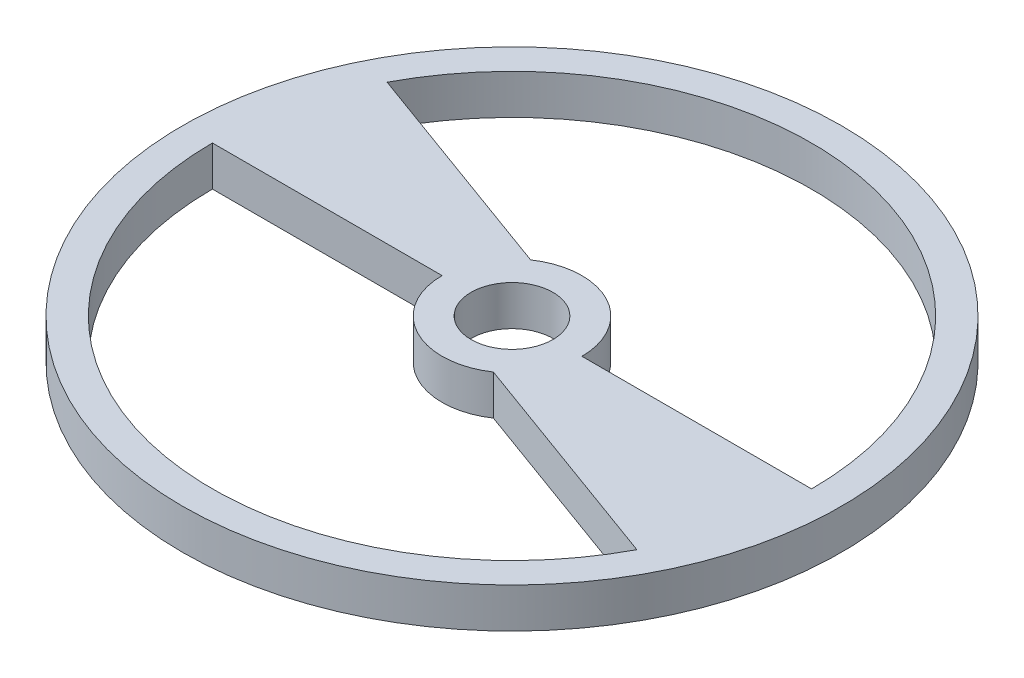
from build123d import *

# Parameters (mm, degrees)
SKETCH1_R           = 16.5
SKETCH1_R_2         = 2.05
BOSS_EXTRUDE1_DEPTH = 2


with BuildPart() as part:
    # Sketch1 → Boss-Extrude1 (new body)
    with BuildSketch(Plane(origin=(0, 0, 0), x_dir=(1, 0, 0), z_dir=(0, 1, 0))):
        with Locations(Location((0, 0, 0), (0, 0, 270))):
            Circle(SKETCH1_R)
        with Locations(Location((0, 0, 0), (0, 0, 270))):
            Circle(SKETCH1_R_2, mode=Mode.SUBTRACT)
        with BuildLine():
            Line((-3.5, 0), (-15, 0))
            ThreePointArc((-15, 0), (-3.610409667, -14.559015833), (13.261992272, -7.008534867))
            Line((13.261992272, -7.008534867), (1.964589624, -2.896616579))
            ThreePointArc((1.964589624, -2.896616579), (-1.639197413, -3.092415212), (-3.5, 0))
        make_face(mode=Mode.SUBTRACT)
        with BuildLine():
            Line((-13.261992272, 7.008534867), (-1.964589624, 2.896616579))
            ThreePointArc((-1.964589624, 2.896616579), (1.639197413, 3.092415212), (3.5, 0))
            Line((3.5, 0), (15, 0))
            ThreePointArc((15, 0), (3.610409667, 14.559015833), (-13.261992272, 7.008534867))
        make_face(mode=Mode.SUBTRACT)
    extrude(amount=BOSS_EXTRUDE1_DEPTH)


solid = part.part
